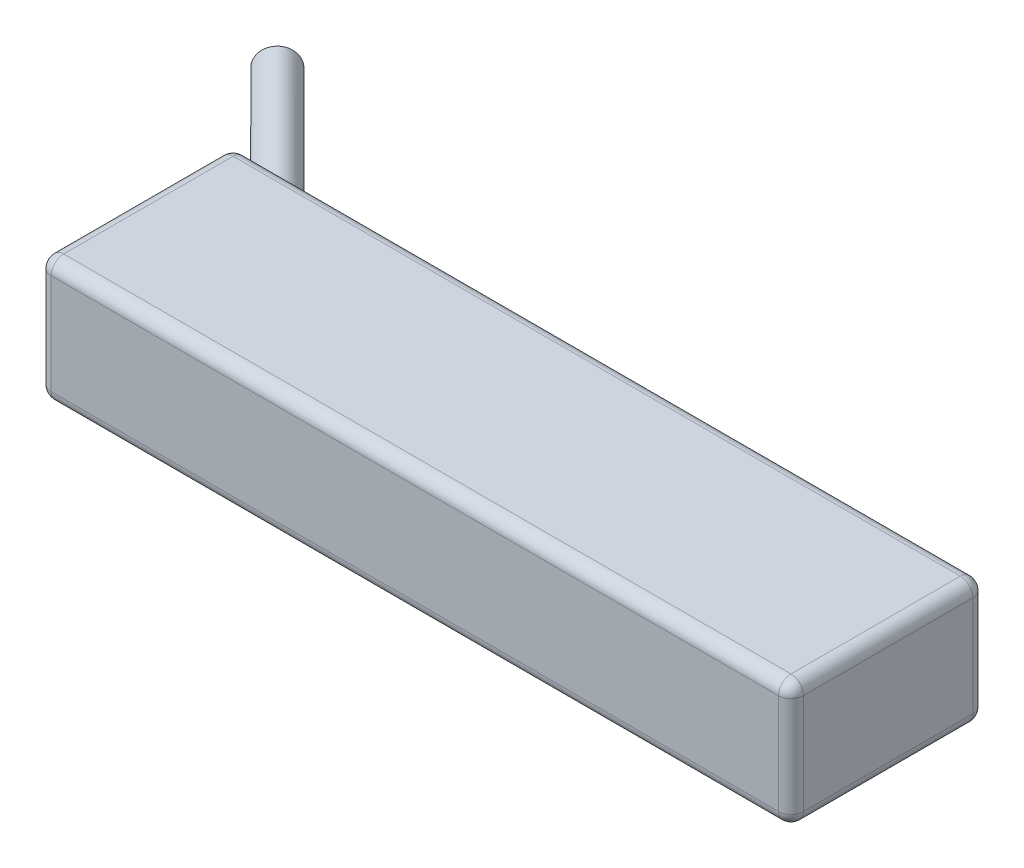
from build123d import *

# Parameters (mm, degrees)
SKETCH1_W           = 120
SKETCH1_H           = 31
BOSS_EXTRUDE1_DEPTH = 10
SKETCH4_R           = 3
BOSS_EXTRUDE2_DEPTH = 30
FILLET1_R           = 2


with BuildPart() as part:
    # Sketch1 → Boss-Extrude1 (new, symmetric)
    with BuildSketch(Plane(origin=(0, 0, 0), x_dir=(1, 0, 0), z_dir=(0, 1, 0))):
        Rectangle(SKETCH1_W, SKETCH1_H)
    extrude(amount=BOSS_EXTRUDE1_DEPTH, both=True)

    # Sketch4 → Boss-Extrude2 (add)
    with BuildSketch(Plane(origin=(-32.75, 0, -32.75), x_dir=(0.7071067811865509, 0, -0.7071067811865442), z_dir=(0.7071067811865442, 0, 0.7071067811865509))):
        with Locations((-26.466251763, 4)):
            Circle(SKETCH4_R)
        with Locations((-26.466251763, -4)):
            Circle(SKETCH4_R)
    extrude(amount=-BOSS_EXTRUDE2_DEPTH)

    # Fillet1
    fillet1_edges = [part.edges().sort_by_distance(p)[0] for p in [
        (60, 0, -15.5),
        (-60, 0, -15.5),
        (-60, 0, 15.5),
        (60, 0, 15.5),
        (0, -10, -15.5),
        (-60, -10, 0),
        (0, -10, 15.5),
        (60, -10, 0),
        (0, 10, 15.5),
        (-60, 10, 0),
        (0, 10, -15.5),
        (60, 10, 0),
    ]]
    fillet(fillet1_edges, radius=FILLET1_R)


solid = part.part
